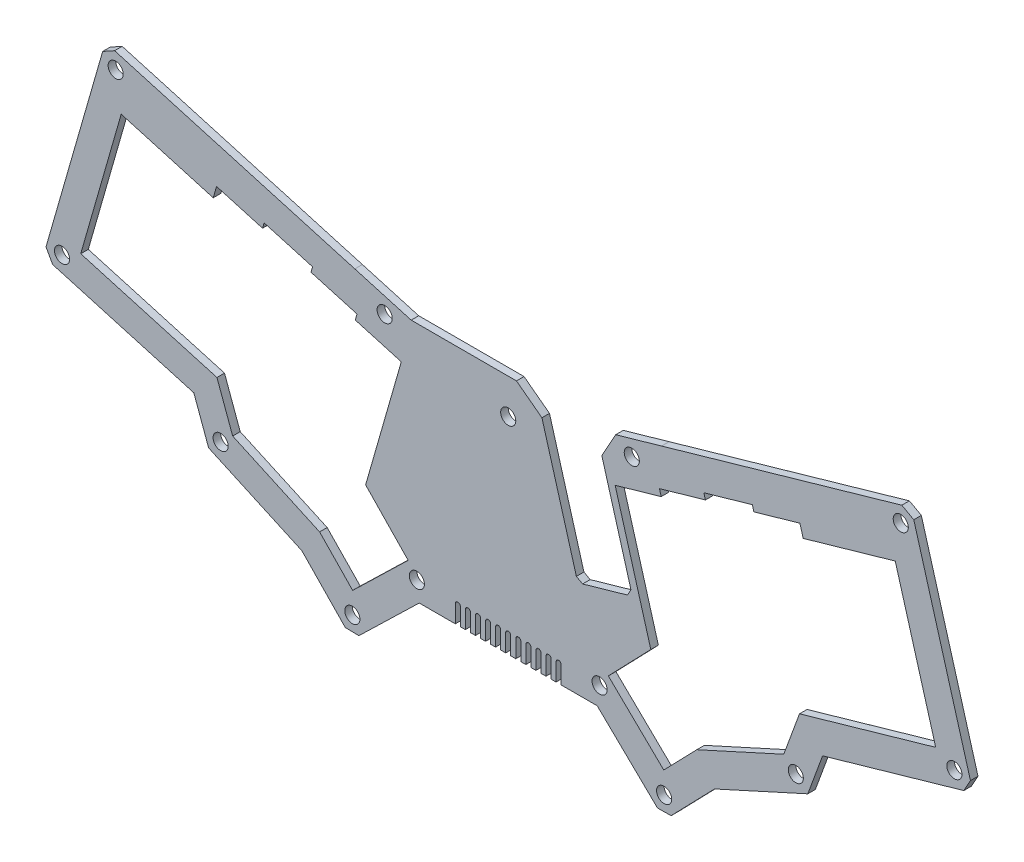
from build123d import *

# Parameters (mm, degrees)
ESQUISSE1_R             = 3
BOSS_EXTRU_1_DEPTH      = 3
ENL_V_MAT_EXTRU_1_DEPTH = 10


with BuildPart() as part:
    # Esquisse1 → Boss.-Extru.1 (new body)
    with BuildSketch(Plane.XY):
        Polygon((-119.070790786, -62.796362516), (-130.649820486, -22.415487094), (-125.164825765, -12.52029468), (-113.628741096, -9.212375631), (-106.903313784, -7.283890382), (-11.566867539, 20.047657387), (-6.831333687, 17.422535954), (15.658421065, -61.008559605), (13.033558244, -65.743937486), (-43.019834736, -81.816989279), (-48.88672074, -97.823971184), (-85.896908628, -114.655437515), (-103.128047086, -132.451258614), (-108.538839937, -132.536382762), (-132.484085232, -109.350948678), (-203.106434511, -109.350948678), (-227.051679806, -132.536382762), (-232.462472657, -132.451258614), (-249.693611115, -114.655437515), (-286.703799003, -97.823971184), (-292.570685007, -81.816989279), (-348.624077987, -65.743937486), (-351.248940808, -61.008559605), (-328.759186056, 17.422535954), (-324.023652204, 20.047657387), (-228.687205959, -7.283890382), (-221.961778647, -9.212375631), (-206.306232172, -13.701531345), (-164.521687886, -13.701531345), (-154.419403971, -21.314148304), (-140.742647218, -69.010667349), (-138.268849115, -70.381916029), (-120.442039466, -65.27016062), align=None)
        with Locations((-12.000450916, 13.68165837)):
            Circle(ESQUISSE1_R, mode=Mode.SUBTRACT)
        with Locations((-118.757933777, -16.924131519)):
            Circle(ESQUISSE1_R, mode=Mode.SUBTRACT)
        with Locations((9.292284284, -60.574933915)):
            Circle(ESQUISSE1_R, mode=Mode.SUBTRACT)
        with Locations((-53.656180266, -93.401689518)):
            Circle(ESQUISSE1_R, mode=Mode.SUBTRACT)
        with Locations((-105.923928137, -126.713325795)):
            Circle(ESQUISSE1_R, mode=Mode.SUBTRACT)
        with Locations((-131.530967037, -101.880200807)):
            Circle(ESQUISSE1_R, mode=Mode.SUBTRACT)
        with Locations((-323.590068827, 13.68165837)):
            Circle(ESQUISSE1_R, mode=Mode.SUBTRACT)
        with Locations((-204.059552706, -101.880200807)):
            Circle(ESQUISSE1_R, mode=Mode.SUBTRACT)
        with Locations((-229.666591606, -126.713325795)):
            Circle(ESQUISSE1_R, mode=Mode.SUBTRACT)
        with Locations((-281.934339477, -93.401689518)):
            Circle(ESQUISSE1_R, mode=Mode.SUBTRACT)
        with Locations((-344.882804027, -60.574933915)):
            Circle(ESQUISSE1_R, mode=Mode.SUBTRACT)
        with Locations((-216.832585966, -16.924131519)):
            Circle(ESQUISSE1_R, mode=Mode.SUBTRACT)
        with Locations((-167.795259872, -27.605548894)):
            Circle(ESQUISSE1_R, mode=Mode.SUBTRACT)
        Polygon((-128.0696158, -96.878899722), (-106.057456456, -118.225792128), (-92.935433745, -104.673746846), (-58.425639792, -88.979407851), (-52.188593581, -71.96249534), (1.870889973, -56.461187875), (-14.186085737, -0.463858857), (-50.716621092, -10.938821309), (-52.025991399, -6.372504389), (-70.291259076, -11.609985616), (-70.910965859, -9.448811229), (-90.137733677, -14.960840928), (-89.517720268, -17.123084647), (-107.782987945, -22.360565873), (-107.093845678, -24.763890567), (-125.358331696, -30.001147656), (-111.200088958, -79.377961929), (-127.377713529, -96.161100182), align=None, mode=Mode.SUBTRACT)
        Polygon((-224.390430785, -79.377961929), (-208.212806214, -96.161100182), (-207.491865187, -96.85509979), (-208.236606037, -97.572971364), (-229.533063287, -118.225792128), (-242.655085998, -104.673746846), (-277.164879951, -88.979407851), (-283.401926162, -71.96249534), (-337.461409717, -56.461187875), (-321.404434006, -0.463858857), (-284.873898651, -10.938821309), (-283.564528345, -6.372504389), (-265.299260667, -11.609985616), (-264.679553884, -9.448811229), (-245.452786066, -14.960840928), (-246.072799476, -17.123084647), (-227.807531798, -22.360565873), (-228.496674065, -24.763890567), (-210.232188047, -30.001147656), align=None, mode=Mode.SUBTRACT)
    extrude(amount=BOSS_EXTRU_1_DEPTH)

    # Esquisse2 → Enlèv. mat.-Extru.1 (cut)
    with BuildSketch(Plane.XY.offset(3)):
        with BuildLine():
            Line((-168.795259872, -109.350948678), (-168.795259872, -102.350948678))
            ThreePointArc((-168.795259872, -102.350948678), (-167.795259872, -101.350948678), (-166.795259872, -102.350948678))
            Line((-166.795259872, -102.350948678), (-166.795259872, -109.350948678))
            ThreePointArc((-166.795259872, -109.350948678), (-167.795259872, -110.350948678), (-168.795259872, -109.350948678))
        make_face()
        with BuildLine():
            Line((-164.795259872, -109.350948678), (-164.795259872, -102.350948678))
            ThreePointArc((-164.795259872, -102.350948678), (-163.795259872, -101.350948678), (-162.795259872, -102.350948678))
            Line((-162.795259872, -102.350948678), (-162.795259872, -109.350948678))
            ThreePointArc((-162.795259872, -109.350948678), (-163.795259872, -110.350948678), (-164.795259872, -109.350948678))
        make_face()
        with BuildLine():
            Line((-160.795259872, -109.350948678), (-160.795259872, -102.350948678))
            ThreePointArc((-160.795259872, -102.350948678), (-159.795259872, -101.350948678), (-158.795259872, -102.350948678))
            Line((-158.795259872, -102.350948678), (-158.795259872, -109.350948678))
            ThreePointArc((-158.795259872, -109.350948678), (-159.795259872, -110.350948678), (-160.795259872, -109.350948678))
        make_face()
        with BuildLine():
            Line((-156.795259872, -109.350948678), (-156.795259872, -102.350948678))
            ThreePointArc((-156.795259872, -102.350948678), (-155.795259872, -101.350948678), (-154.795259872, -102.350948678))
            Line((-154.795259872, -102.350948678), (-154.795259872, -109.350948678))
            ThreePointArc((-154.795259872, -109.350948678), (-155.795259872, -110.350948678), (-156.795259872, -109.350948678))
        make_face()
        with BuildLine():
            Line((-152.795259872, -109.350948678), (-152.795259872, -102.350948678))
            ThreePointArc((-152.795259872, -102.350948678), (-151.795259872, -101.350948678), (-150.795259872, -102.350948678))
            Line((-150.795259872, -102.350948678), (-150.795259872, -109.350948678))
            ThreePointArc((-150.795259872, -109.350948678), (-151.795259872, -110.350948678), (-152.795259872, -109.350948678))
        make_face()
        with BuildLine():
            Line((-148.795259872, -109.350948678), (-148.795259872, -102.350948678))
            ThreePointArc((-148.795259872, -102.350948678), (-147.795259872, -101.350948678), (-146.795259872, -102.350948678))
            Line((-146.795259872, -102.350948678), (-146.795259872, -109.350948678))
            ThreePointArc((-146.795259872, -109.350948678), (-147.795259872, -110.350948678), (-148.795259872, -109.350948678))
        make_face()
        with BuildLine():
            Line((-172.795259872, -109.350948678), (-172.795259872, -102.350948678))
            ThreePointArc((-172.795259872, -102.350948678), (-171.795259872, -101.350948678), (-170.795259872, -102.350948678))
            Line((-170.795259872, -102.350948678), (-170.795259872, -109.350948678))
            ThreePointArc((-170.795259872, -109.350948678), (-171.795259872, -110.350948678), (-172.795259872, -109.350948678))
        make_face()
        with BuildLine():
            Line((-176.795259872, -109.350948678), (-176.795259872, -102.350948678))
            ThreePointArc((-176.795259872, -102.350948678), (-175.795259872, -101.350948678), (-174.795259872, -102.350948678))
            Line((-174.795259872, -102.350948678), (-174.795259872, -109.350948678))
            ThreePointArc((-174.795259872, -109.350948678), (-175.795259872, -110.350948678), (-176.795259872, -109.350948678))
        make_face()
        with BuildLine():
            Line((-180.795259872, -109.350948678), (-180.795259872, -102.350948678))
            ThreePointArc((-180.795259872, -102.350948678), (-179.795259872, -101.350948678), (-178.795259872, -102.350948678))
            Line((-178.795259872, -102.350948678), (-178.795259872, -109.350948678))
            ThreePointArc((-178.795259872, -109.350948678), (-179.795259872, -110.350948678), (-180.795259872, -109.350948678))
        make_face()
        with BuildLine():
            Line((-184.795259872, -109.350948678), (-184.795259872, -102.350948678))
            ThreePointArc((-184.795259872, -102.350948678), (-183.795259872, -101.350948678), (-182.795259872, -102.350948678))
            Line((-182.795259872, -102.350948678), (-182.795259872, -109.350948678))
            ThreePointArc((-182.795259872, -109.350948678), (-183.795259872, -110.350948678), (-184.795259872, -109.350948678))
        make_face()
        with BuildLine():
            Line((-188.795259872, -109.350948678), (-188.795259872, -102.350948678))
            ThreePointArc((-188.795259872, -102.350948678), (-187.795259872, -101.350948678), (-186.795259872, -102.350948678))
            Line((-186.795259872, -102.350948678), (-186.795259872, -109.350948678))
            ThreePointArc((-186.795259872, -109.350948678), (-187.795259872, -110.350948678), (-188.795259872, -109.350948678))
        make_face()
    extrude(amount=-ENL_V_MAT_EXTRU_1_DEPTH, mode=Mode.SUBTRACT)


solid = part.part
